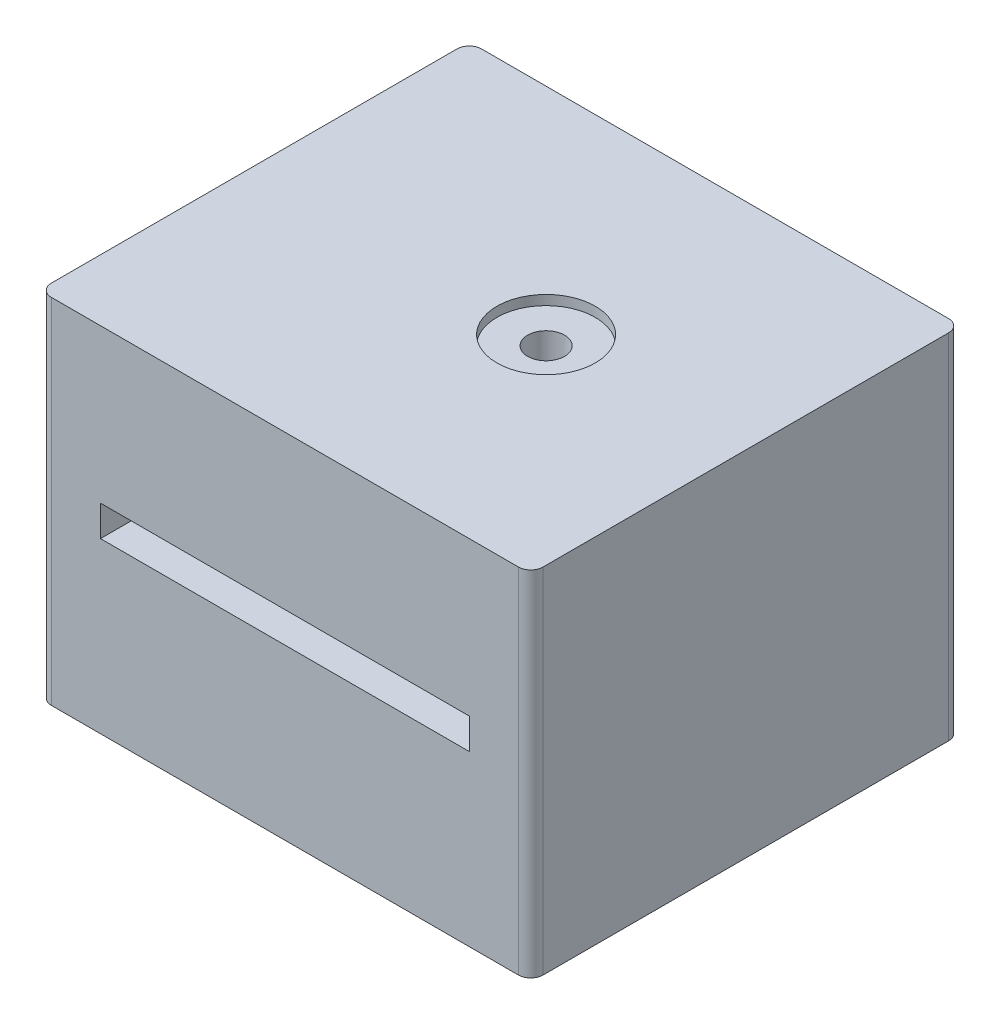
from build123d import *

# Parameters (mm, degrees)
BOX_EXTRUDE_DEPTH             = 100
BOX_EXTRUDE_DEPTH_BACK        = 15
SKETCH2_W                     = 160
SKETCH2_H                     = 140
BOX_INNER_CUT_START           = -20
SKETCH3_W                     = 120
SKETCH3_H                     = 100
BOX_INNER_CUT_DEPTH           = 40
SHAFT_CUT_START               = -60
SKETCH6_R                     = 6
SHAFT_CUT_DEPTH               = 40
BEARING_CUTS_INSIDE_BOX_START = -60
SKETCH9_R                     = 8
SKETCH9_R_2                   = 16
BEARING_CUTS_INSIDE_BOX_DEPTH = 10
SKETCH11_W                    = 120
SKETCH11_H                    = 10
SCISSOR_CUT_DEPTH             = 20
SKETCH12_R                    = 16
MOTOR_HOLE_CUT_DEPTH          = 3.15
RIGHT_SHAFT_LID_CUT_REACH     = 156.306
SKETCH15_R                    = 6
LEFT_BEARING_LID_CUT_START    = -10
SKETCH18_R                    = 8
LEFT_BEARING_LID_CUT_DEPTH    = 10
OUTER_EDGES_FILLET_R          = 4


with BuildPart() as part:
    # Sketch2 → BOX_EXTRUDE (new, two sides: drawn at the far end of the back side and taken through both)
    with BuildSketch(Plane(origin=(0, 0, 0), x_dir=(1, 0, 0), z_dir=(0, 1, 0)).offset(-BOX_EXTRUDE_DEPTH_BACK)):
        Rectangle(SKETCH2_W, SKETCH2_H)
    extrude(amount=BOX_EXTRUDE_DEPTH + BOX_EXTRUDE_DEPTH_BACK)

    # Sketch3 → BOX_INNER_CUT (cut)
    with BuildSketch(Plane(origin=(0, 100, 0), x_dir=(1, 0, 0), z_dir=(0, 1, 0)).offset(BOX_INNER_CUT_START)):
        Rectangle(SKETCH3_W, SKETCH3_H)
    extrude(amount=-BOX_INNER_CUT_DEPTH, mode=Mode.SUBTRACT)

    # Sketch6 → SHAFT_CUT (cut)
    with BuildSketch(Plane(origin=(0, 100, 0), x_dir=(1, 0, 0), z_dir=(0, 1, 0)).offset(SHAFT_CUT_START)):
        with Locations(Location((15, 0, 0), (0, 0, 270))):
            Circle(SKETCH6_R)
        with Locations(Location((-15, 0, 0), (0, 0, 90))):
            Circle(SKETCH6_R)
    extrude(amount=-SHAFT_CUT_DEPTH, mode=Mode.SUBTRACT)

    # Sketch9 → BEARING_CUTS_INSIDE_BOX (cut)
    with BuildSketch(Plane(origin=(0, 100, 0), x_dir=(1, 0, 0), z_dir=(0, 1, 0)).offset(BEARING_CUTS_INSIDE_BOX_START)):
        with Locations(Location((15, 0, 0), (0, 0, 270))):
            Circle(SKETCH9_R)
        with Locations(Location((-15, 0, 0), (0, 0, 270))):
            Circle(SKETCH9_R_2)
    extrude(amount=-BEARING_CUTS_INSIDE_BOX_DEPTH, mode=Mode.SUBTRACT)

    # Sketch11 → SCISSOR_CUT (cut)
    with BuildSketch(Plane.XY.offset(70)):
        with Locations((0, 45)):
            Rectangle(SKETCH11_W, SKETCH11_H)
    extrude(amount=-SCISSOR_CUT_DEPTH, mode=Mode.SUBTRACT)

    # Sketch12 → MOTOR_HOLE_CUT (cut)
    with BuildSketch(Plane(origin=(0, 100, 0), x_dir=(1, 0, 0), z_dir=(0, 1, 0))):
        with Locations(Location((15, 0, 0), (0, 0, 270))):
            Circle(SKETCH12_R)
    extrude(amount=-MOTOR_HOLE_CUT_DEPTH, mode=Mode.SUBTRACT)

    # Sketch15 → RIGHT_SHAFT_LID_CUT (cut, up to next)
    with BuildSketch(Plane(origin=(0, 96.85, 0), x_dir=(1, 0, 0), z_dir=(0, 1, 0)), mode=Mode.PRIVATE) as right_shaft_lid_cut_sk1:
        with Locations(Location((15, 0, 0), (0, 0, 270))):
            Circle(SKETCH15_R)
    right_shaft_lid_cut_tool1 = extrude(right_shaft_lid_cut_sk1.sketch, amount=-RIGHT_SHAFT_LID_CUT_REACH, mode=Mode.PRIVATE) & part.part
    add(right_shaft_lid_cut_tool1.solids().sort_by_distance((15, 96.85, 0))[0], mode=Mode.SUBTRACT)

    # Sketch18 → LEFT_BEARING_LID_CUT (cut)
    with BuildSketch(Plane(origin=(0, 100, 0), x_dir=(1, 0, 0), z_dir=(0, 1, 0)).offset(LEFT_BEARING_LID_CUT_START)):
        with Locations(Location((-15, 0, 0), (0, 0, 270))):
            Circle(SKETCH18_R)
    extrude(amount=-LEFT_BEARING_LID_CUT_DEPTH, mode=Mode.SUBTRACT)

    # OUTER_EDGES_FILLET
    outer_edges_fillet_edges = [part.edges().sort_by_distance(p)[0] for p in [
        (-80, 42.5, -70),
        (80, 42.5, -70),
        (80, 42.5, 70),
        (-80, 42.5, 70),
    ]]
    fillet(outer_edges_fillet_edges, radius=OUTER_EDGES_FILLET_R)


solid = part.part
